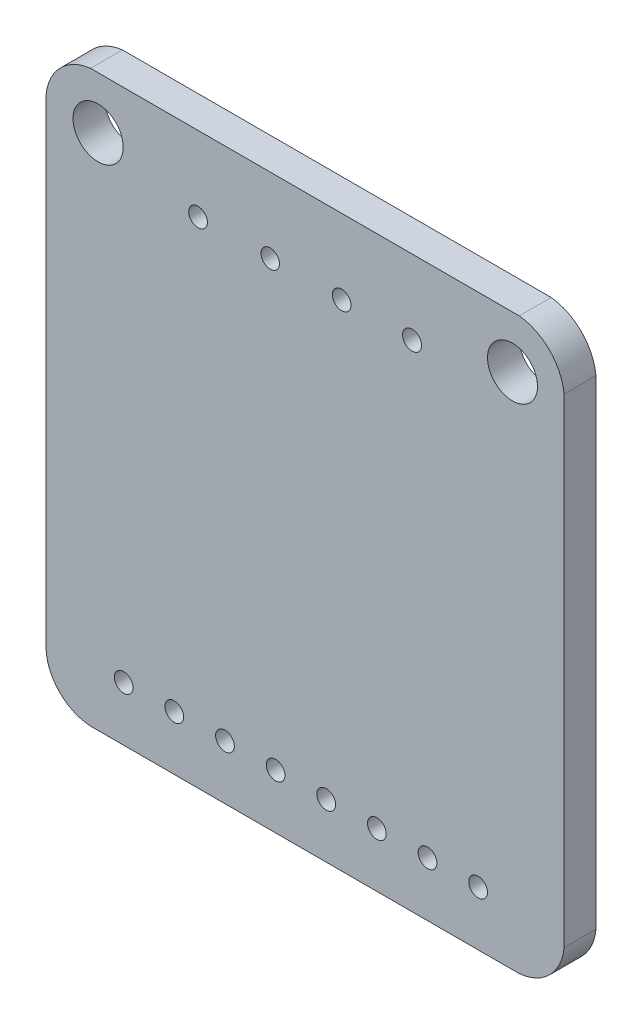
from build123d import *

# Parameters (mm, degrees)
ESQUISSE2_R        = 0.467909586
ESQUISSE2_R_2      = 0.462515637
ESQUISSE2_R_3      = 0.468000509
ESQUISSE2_R_4      = 0.477564987
ESQUISSE2_R_5      = 0.470168228
ESQUISSE2_R_6      = 1.259214128
ESQUISSE2_R_7      = 1.254727482
BOSS_EXTRU_1_DEPTH = 1.6


with BuildPart() as part:
    # Esquisse2 → Boss.-Extru.1 (new body)
    with BuildSketch(Plane.XY):
        with BuildLine():
            Line((-10.763692571, 13.565011818), (10.74581851, 13.565011818))
            ThreePointArc((10.74581851, 13.565011818), (12.271911831, 12.826957517), (12.994133377, 11.293307944))
            Line((12.994133377, 11.293307944), (12.994133377, -12.750865198))
            ThreePointArc((12.994133377, -12.750865198), (12.280339364, -14.289408789), (10.74581851, -15.011810356))
            Line((10.74581851, -15.011810356), (-10.763692571, -15.011810356))
            ThreePointArc((-10.763692571, -15.011810356), (-12.317789283, -14.313780824), (-12.995842793, -12.750865198))
            Line((-12.995842793, -12.750865198), (-12.995842793, 11.293307944))
            ThreePointArc((-12.995842793, 11.293307944), (-12.280612826, 12.823025731), (-10.763692571, 13.565011818))
        make_face()
        with Locations((-5.368245779, 9.803011338)):
            Circle(ESQUISSE2_R, mode=Mode.SUBTRACT)
        with Locations((-1.747506546, 9.808625056)):
            Circle(ESQUISSE2_R_2, mode=Mode.SUBTRACT)
        with Locations((1.836568036, 9.802601595)):
            Circle(ESQUISSE2_R_3, mode=Mode.SUBTRACT)
        with Locations((5.368115737, 9.823514191)):
            Circle(ESQUISSE2_R_4, mode=Mode.SUBTRACT)
        with Locations((-9.098090861, -12.281044951)):
            Circle(ESQUISSE2_R_5, mode=Mode.SUBTRACT)
        with Locations((-6.558090861, -12.281044951)):
            Circle(ESQUISSE2_R_5, mode=Mode.SUBTRACT)
        with Locations((-4.018090861, -12.281044951)):
            Circle(ESQUISSE2_R_5, mode=Mode.SUBTRACT)
        with Locations((-1.478090861, -12.281044951)):
            Circle(ESQUISSE2_R_5, mode=Mode.SUBTRACT)
        with Locations((1.061909139, -12.281044951)):
            Circle(ESQUISSE2_R_5, mode=Mode.SUBTRACT)
        with Locations((3.601909139, -12.281044951)):
            Circle(ESQUISSE2_R_5, mode=Mode.SUBTRACT)
        with Locations((6.141909139, -12.281044951)):
            Circle(ESQUISSE2_R_5, mode=Mode.SUBTRACT)
        with Locations((8.681909139, -12.281044951)):
            Circle(ESQUISSE2_R_5, mode=Mode.SUBTRACT)
        with Locations((-10.381208979, 10.950397668)):
            Circle(ESQUISSE2_R_6, mode=Mode.SUBTRACT)
        with Locations((10.405240916, 10.954411998)):
            Circle(ESQUISSE2_R_7, mode=Mode.SUBTRACT)
    extrude(amount=BOSS_EXTRU_1_DEPTH)


solid = part.part
